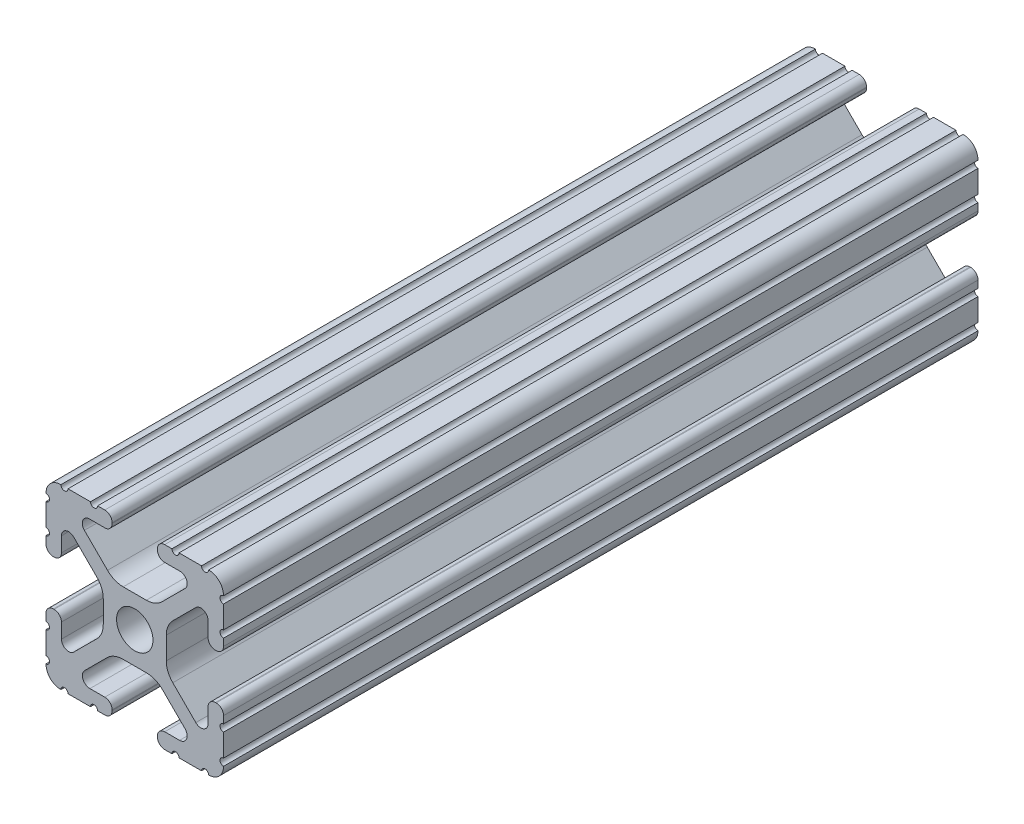
from build123d import *

# Parameters (mm, degrees)
SKETCH1_R           = 2.6035
BOSS_EXTRUDE1_DEPTH = 53.975


with BuildPart() as part:
    # Sketch1 → Boss-Extrude1 (new, symmetric)
    with BuildSketch(Plane.XY):
        with BuildLine():
            Line((-7.179650497, -8.645192506), (-3.952270251, -5.423690499))
            ThreePointArc((-3.952270251, -5.423690499), (-2.922936451, -4.736929036), (-1.709253557, -4.4958))
            Line((-1.709253557, -4.4958), (1.709253557, -4.4958))
            ThreePointArc((1.709253557, -4.4958), (2.922936451, -4.736929036), (3.952270251, -5.423690499))
            Line((3.952270251, -5.423690499), (7.179650497, -8.645192506))
            ThreePointArc((7.179650497, -8.645192506), (7.41473083, -9.822813117), (6.416408329, -10.4902))
            Line((6.416408329, -10.4902), (4.287512407, -10.4902))
            ThreePointArc((4.287512407, -10.4902), (3.54574862, -10.79744862), (3.2385, -11.539212407))
            Line((3.2385, -11.539212407), (3.2385, -11.650987593))
            ThreePointArc((3.2385, -11.650987593), (3.54574862, -12.39275138), (4.287512407, -12.7))
            Line((4.287512407, -12.7), (5.317126718, -12.7))
            ThreePointArc((5.317126718, -12.7), (5.825126718, -12.192), (6.333126718, -12.7))
            Line((6.333126718, -12.7), (9.550443118, -12.7))
            ThreePointArc((9.550443118, -12.7), (10.058366869, -12.192000006), (10.566443095, -12.699847501))
            ThreePointArc((10.566443095, -12.699847501), (12.082537762, -12.08250727), (12.699846982, -10.566399977))
            ThreePointArc((12.699846982, -10.566399977), (12.192000006, -10.058323491), (12.7, -9.5504))
            Line((12.7, -9.5504), (12.7, -6.3330836))
            ThreePointArc((12.7, -6.3330836), (12.192, -5.8250836), (12.7, -5.3170836))
            Line((12.7, -5.3170836), (12.7, -4.287469289))
            ThreePointArc((12.7, -4.287469289), (12.39275138, -3.545705502), (11.650987593, -3.238456882))
            Line((11.650987593, -3.238456882), (11.539212407, -3.238456882))
            ThreePointArc((11.539212407, -3.238456882), (10.79744862, -3.545705502), (10.4902, -4.287469289))
            Line((10.4902, -4.287469289), (10.4902, -6.402089023))
            ThreePointArc((10.4902, -6.402089023), (9.856505071, -7.351067942), (8.737131347, -7.129408934))
            Line((8.737131347, -7.129408934), (5.441005833, -3.840816462))
            ThreePointArc((5.441005833, -3.840816462), (4.750877967, -2.809883091), (4.5085, -1.593185507))
            Line((4.5085, -1.593185507), (4.5085, 1.593185507))
            ThreePointArc((4.5085, 1.593185507), (4.750877967, 2.809883091), (5.441005833, 3.840816462))
            Line((5.441005833, 3.840816462), (8.737131347, 7.129408934))
            ThreePointArc((8.737131347, 7.129408934), (9.856505071, 7.351067942), (10.4902, 6.402089023))
            Line((10.4902, 6.402089023), (10.4902, 4.287469289))
            ThreePointArc((10.4902, 4.287469289), (10.79744862, 3.545705502), (11.539212407, 3.238456882))
            Line((11.539212407, 3.238456882), (11.650987593, 3.238456882))
            ThreePointArc((11.650987593, 3.238456882), (12.39275138, 3.545705502), (12.7, 4.287469289))
            Line((12.7, 4.287469289), (12.7, 5.3170836))
            ThreePointArc((12.7, 5.3170836), (12.192, 5.8250836), (12.7, 6.3330836))
            Line((12.7, 6.3330836), (12.7, 9.5504))
            ThreePointArc((12.7, 9.5504), (12.192000006, 10.058323491), (12.699846982, 10.566399977))
            ThreePointArc((12.699846982, 10.566399977), (12.082537762, 12.08250727), (10.566443095, 12.699847501))
            ThreePointArc((10.566443095, 12.699847501), (10.058366869, 12.192000006), (9.550443118, 12.7))
            Line((9.550443118, 12.7), (6.333126718, 12.7))
            ThreePointArc((6.333126718, 12.7), (5.825126718, 12.192), (5.317126718, 12.7))
            Line((5.317126718, 12.7), (4.287512407, 12.7))
            ThreePointArc((4.287512407, 12.7), (3.54574862, 12.39275138), (3.2385, 11.650987593))
            Line((3.2385, 11.650987593), (3.2385, 11.539212407))
            ThreePointArc((3.2385, 11.539212407), (3.54574862, 10.79744862), (4.287512407, 10.4902))
            Line((4.287512407, 10.4902), (6.476788598, 10.4902))
            ThreePointArc((6.476788598, 10.4902), (7.432222385, 9.85140422), (7.207036008, 8.724370562))
            Line((7.207036008, 8.724370562), (3.898272566, 5.423169045))
            ThreePointArc((3.898272566, 5.423169045), (2.869120213, 4.736787962), (1.655778399, 4.4958))
            Line((1.655778399, 4.4958), (-1.655778399, 4.4958))
            ThreePointArc((-1.655778399, 4.4958), (-2.869120213, 4.736787962), (-3.898272566, 5.423169045))
            Line((-3.898272566, 5.423169045), (-7.207036008, 8.724370562))
            ThreePointArc((-7.207036008, 8.724370562), (-7.432222385, 9.85140422), (-6.476788598, 10.4902))
            Line((-6.476788598, 10.4902), (-4.287512407, 10.4902))
            ThreePointArc((-4.287512407, 10.4902), (-3.54574862, 10.79744862), (-3.2385, 11.539212407))
            Line((-3.2385, 11.539212407), (-3.2385, 11.650987593))
            ThreePointArc((-3.2385, 11.650987593), (-3.54574862, 12.39275138), (-4.287512407, 12.7))
            Line((-4.287512407, 12.7), (-5.317126718, 12.7))
            ThreePointArc((-5.317126718, 12.7), (-5.825126718, 12.192), (-6.333126718, 12.7))
            Line((-6.333126718, 12.7), (-9.550443118, 12.7))
            ThreePointArc((-9.550443118, 12.7), (-10.058366869, 12.192000006), (-10.566443095, 12.699847501))
            ThreePointArc((-10.566443095, 12.699847501), (-12.082537762, 12.08250727), (-12.699846982, 10.566399977))
            ThreePointArc((-12.699846982, 10.566399977), (-12.192000006, 10.058323491), (-12.7, 9.5504))
            Line((-12.7, 9.5504), (-12.7, 6.3330836))
            ThreePointArc((-12.7, 6.3330836), (-12.192, 5.8250836), (-12.7, 5.3170836))
            Line((-12.7, 5.3170836), (-12.7, 4.287469289))
            ThreePointArc((-12.7, 4.287469289), (-12.39275138, 3.545705502), (-11.650987593, 3.238456882))
            Line((-11.650987593, 3.238456882), (-11.539212407, 3.238456882))
            ThreePointArc((-11.539212407, 3.238456882), (-10.79744862, 3.545705502), (-10.4902, 4.287469289))
            Line((-10.4902, 4.287469289), (-10.4902, 6.402089023))
            ThreePointArc((-10.4902, 6.402089023), (-9.856505071, 7.351067942), (-8.737131347, 7.129408934))
            Line((-8.737131347, 7.129408934), (-5.441005833, 3.840816462))
            ThreePointArc((-5.441005833, 3.840816462), (-4.750877967, 2.809883091), (-4.5085, 1.593185507))
            Line((-4.5085, 1.593185507), (-4.5085, -1.593185507))
            ThreePointArc((-4.5085, -1.593185507), (-4.750877967, -2.809883091), (-5.441005833, -3.840816462))
            Line((-5.441005833, -3.840816462), (-8.737131347, -7.129408934))
            ThreePointArc((-8.737131347, -7.129408934), (-9.856505071, -7.351067942), (-10.4902, -6.402089023))
            Line((-10.4902, -6.402089023), (-10.4902, -4.287469289))
            ThreePointArc((-10.4902, -4.287469289), (-10.79744862, -3.545705502), (-11.539212407, -3.238456882))
            Line((-11.539212407, -3.238456882), (-11.650987593, -3.238456882))
            ThreePointArc((-11.650987593, -3.238456882), (-12.39275138, -3.545705502), (-12.7, -4.287469289))
            Line((-12.7, -4.287469289), (-12.7, -5.3170836))
            ThreePointArc((-12.7, -5.3170836), (-12.192, -5.8250836), (-12.7, -6.3330836))
            Line((-12.7, -6.3330836), (-12.7, -9.5504))
            ThreePointArc((-12.7, -9.5504), (-12.192000006, -10.058323491), (-12.699846982, -10.566399977))
            ThreePointArc((-12.699846982, -10.566399977), (-12.082537762, -12.08250727), (-10.566443095, -12.699847501))
            ThreePointArc((-10.566443095, -12.699847501), (-10.058366869, -12.192000006), (-9.550443118, -12.7))
            Line((-9.550443118, -12.7), (-6.333126718, -12.7))
            ThreePointArc((-6.333126718, -12.7), (-5.825126718, -12.192), (-5.317126718, -12.7))
            Line((-5.317126718, -12.7), (-4.287512407, -12.7))
            ThreePointArc((-4.287512407, -12.7), (-3.54574862, -12.39275138), (-3.2385, -11.650987593))
            Line((-3.2385, -11.650987593), (-3.2385, -11.539212407))
            ThreePointArc((-3.2385, -11.539212407), (-3.54574862, -10.79744862), (-4.287512407, -10.4902))
            Line((-4.287512407, -10.4902), (-6.416408329, -10.4902))
            ThreePointArc((-6.416408329, -10.4902), (-7.41473083, -9.822813117), (-7.179650497, -8.645192506))
        make_face()
        Circle(SKETCH1_R, mode=Mode.SUBTRACT)
    extrude(amount=BOSS_EXTRUDE1_DEPTH, both=True)


solid = part.part
